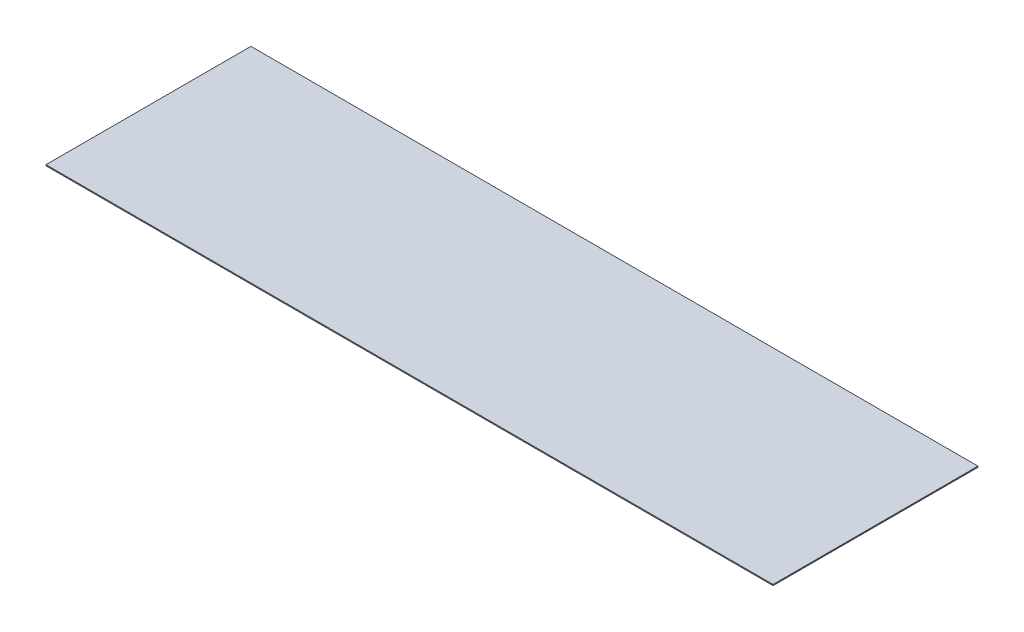
from build123d import *

# Parameters (mm, degrees)
SKETCH1_W           = 1100
SKETCH1_H           = 310
BOSS_EXTRUDE1_DEPTH = 1.5875


with BuildPart() as part:
    # Sketch1 → Boss-Extrude1 (new body)
    with BuildSketch(Plane(origin=(0, 0, 0), x_dir=(1, 0, 0), z_dir=(0, 1, 0))):
        with Locations((550, 155)):
            Rectangle(SKETCH1_W, SKETCH1_H)
    extrude(amount=BOSS_EXTRUDE1_DEPTH)


solid = part.part
